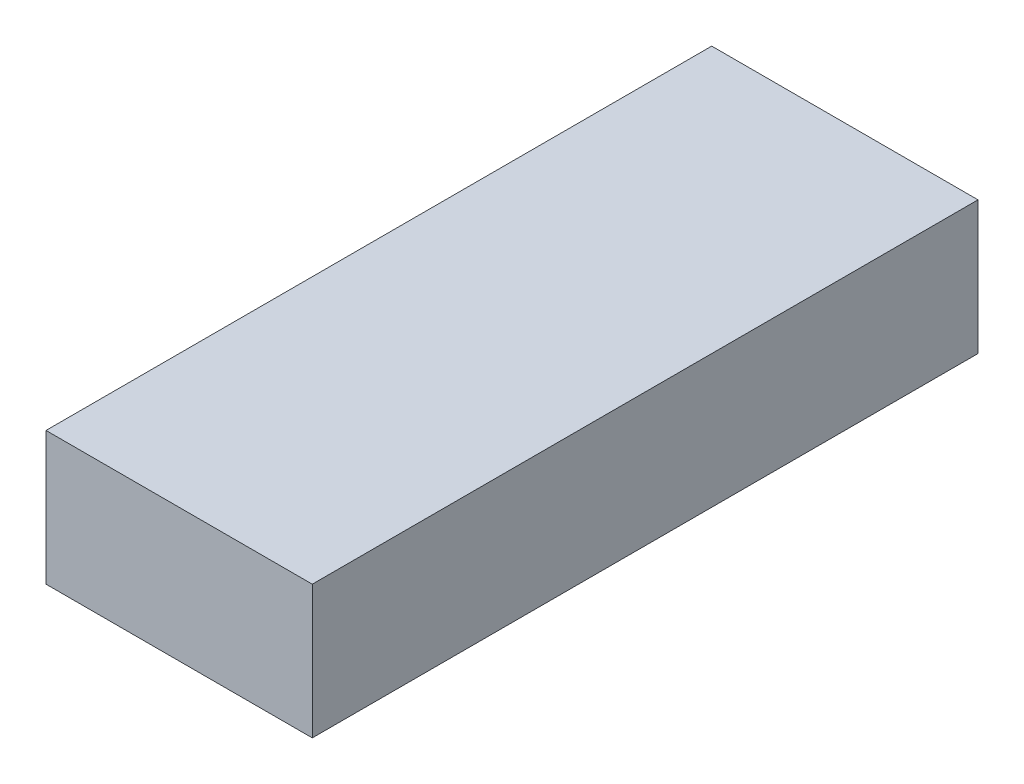
from build123d import *

# Parameters (mm, degrees)
SKETCH1_W           = 50.8
SKETCH1_H           = 127
BOSS_EXTRUDE1_DEPTH = 25.4


with BuildPart() as part:
    # Sketch1 → Boss-Extrude1 (new body)
    with BuildSketch(Plane(origin=(0, 0, 0), x_dir=(1, 0, 0), z_dir=(0, 1, 0))):
        with Locations((25.4, 63.5)):
            Rectangle(SKETCH1_W, SKETCH1_H)
    extrude(amount=BOSS_EXTRUDE1_DEPTH)


solid = part.part
